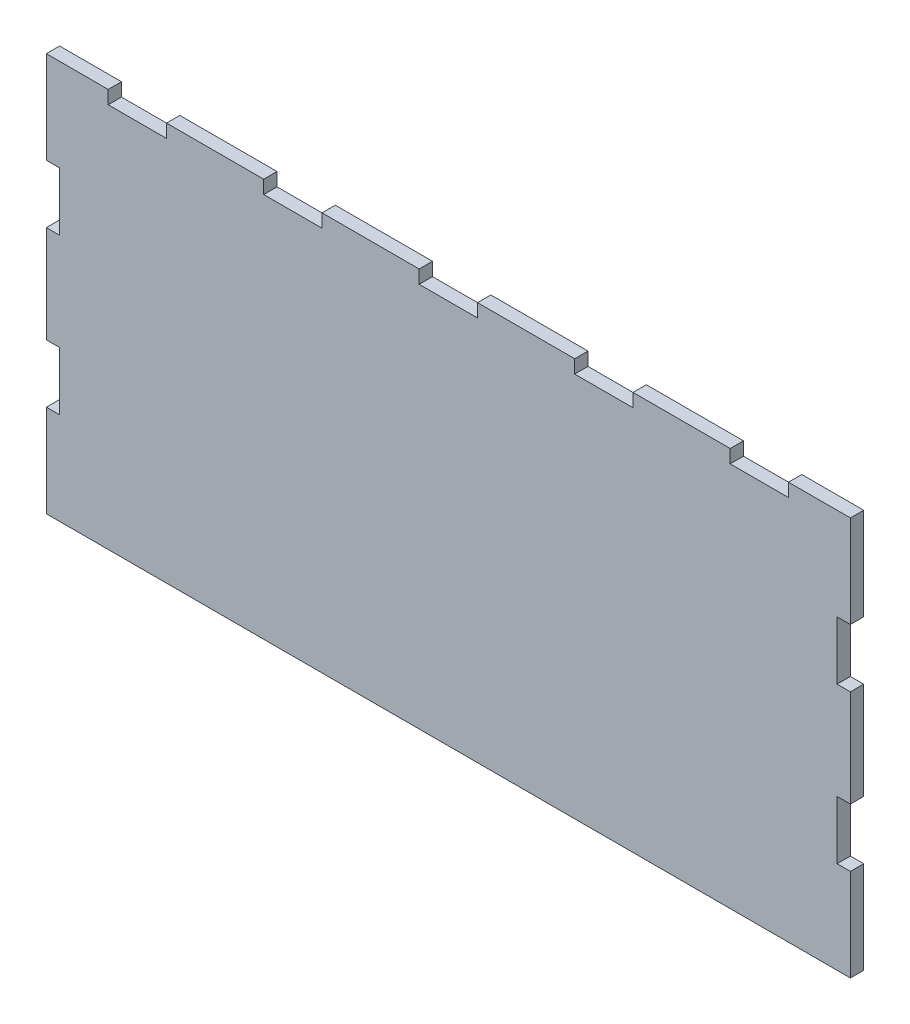
from build123d import *

# Parameters (mm, degrees)
SKETCH1_W           = 262.6868
SKETCH1_H           = 130.175
BOSS_EXTRUDE1_DEPTH = 4.3434
SKETCH2_W           = 19.05
SKETCH2_H           = 8.6868
CUT_EXTRUDE1_DEPTH  = 147.650388692
SKETCH3_W           = 8.6868
SKETCH3_H           = 19.05
CUT_EXTRUDE3_DEPTH  = 147.650388692


with BuildPart() as part:
    # Sketch1 → Boss-Extrude1 (new body)
    with BuildSketch(Plane.XY):
        Rectangle(SKETCH1_W, SKETCH1_H)
    extrude(amount=BOSS_EXTRUDE1_DEPTH)

    # Sketch2 → Cut-Extrude1 (cut, through all)
    with BuildSketch(Plane.XY.offset(4.3434)):
        with Locations((-50.8, 65.0875)):
            Rectangle(SKETCH2_W, SKETCH2_H)
        with Locations((0, 65.0875)):
            Rectangle(SKETCH2_W, SKETCH2_H)
        with Locations((50.8, 65.0875)):
            Rectangle(SKETCH2_W, SKETCH2_H)
        with Locations((101.6, 65.0875)):
            Rectangle(SKETCH2_W, SKETCH2_H)
        with Locations((-101.6, 65.0875)):
            Rectangle(SKETCH2_W, SKETCH2_H)
    extrude(amount=-CUT_EXTRUDE1_DEPTH, mode=Mode.SUBTRACT)

    # Sketch3 → Cut-Extrude3 (cut, through all)
    with BuildSketch(Plane.XY.offset(4.3434)):
        with Locations((-131.3434, -25.4)):
            Rectangle(SKETCH3_W, SKETCH3_H)
        with Locations((-131.3434, 25.4)):
            Rectangle(SKETCH3_W, SKETCH3_H)
    cut_extrude3 = extrude(amount=-CUT_EXTRUDE3_DEPTH, mode=Mode.SUBTRACT)

    # Mirror1: Cut-Extrude3 across plane
    add(cut_extrude3.mirror(Plane(origin=(0, 0, 0), x_dir=(0, 0, 1), z_dir=(1, 0, 0))), mode=Mode.SUBTRACT)


solid = part.part
